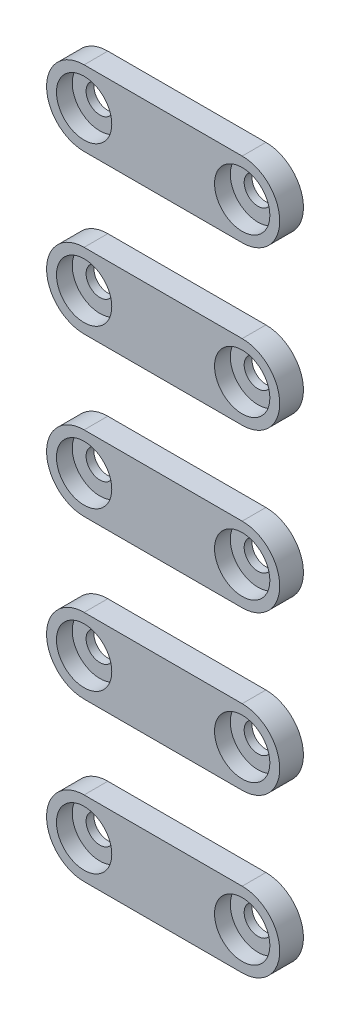
from build123d import *

# Parameters (mm, degrees)
BOSS_EXTRUDE1_DEPTH   = 3
BOSS_EXTRUDE1_2_DEPTH = 3
BOSS_EXTRUDE1_3_DEPTH = 3
BOSS_EXTRUDE1_4_DEPTH = 3
BOSS_EXTRUDE1_5_DEPTH = 3
SKETCH2_R             = 1.75
CUT_EXTRUDE1_DEPTH    = 3
SKETCH3_R             = 3.5
CUT_EXTRUDE2_DEPTH    = 2


with BuildPart() as part:
    # Sketch1 → Boss-Extrude1 (new body)
    with BuildSketch(Plane.XY.offset(-1)):
        with BuildLine():
            Line((10, -4.75), (-10, -4.75))
            ThreePointArc((-10, -4.75), (-14.75, 0), (-10, 4.75))
            Line((-10, 4.75), (10, 4.75))
            ThreePointArc((10, 4.75), (14.75, 0), (10, -4.75))
        make_face()
    extrude(amount=BOSS_EXTRUDE1_DEPTH)


with BuildPart() as body_2:
    # Sketch1 → Boss-Extrude1 2 (new body)
    with BuildSketch(Plane.XY.offset(-1)):
        with BuildLine():
            Line((10, 15.25), (-10, 15.25))
            ThreePointArc((-10, 15.25), (-14.75, 20), (-10, 24.75))
            Line((-10, 24.75), (10, 24.75))
            ThreePointArc((10, 24.75), (14.75, 20), (10, 15.25))
        make_face()
    extrude(amount=BOSS_EXTRUDE1_2_DEPTH)


with BuildPart() as body_3:
    # Sketch1 → Boss-Extrude1 3 (new body)
    with BuildSketch(Plane.XY.offset(-1)):
        with BuildLine():
            Line((10, 35.25), (-10, 35.25))
            ThreePointArc((-10, 35.25), (-14.75, 40), (-10, 44.75))
            Line((-10, 44.75), (10, 44.75))
            ThreePointArc((10, 44.75), (14.75, 40), (10, 35.25))
        make_face()
    extrude(amount=BOSS_EXTRUDE1_3_DEPTH)


with BuildPart() as body_4:
    # Sketch1 → Boss-Extrude1 4 (new body)
    with BuildSketch(Plane.XY.offset(-1)):
        with BuildLine():
            Line((10, -24.75), (-10, -24.75))
            ThreePointArc((-10, -24.75), (-14.75, -20), (-10, -15.25))
            Line((-10, -15.25), (10, -15.25))
            ThreePointArc((10, -15.25), (14.75, -20), (10, -24.75))
        make_face()
    extrude(amount=BOSS_EXTRUDE1_4_DEPTH)


with BuildPart() as body_5:
    # Sketch1 → Boss-Extrude1 5 (new body)
    with BuildSketch(Plane.XY.offset(-1)):
        with BuildLine():
            Line((10, -44.75), (-10, -44.75))
            ThreePointArc((-10, -44.75), (-14.75, -40), (-10, -35.25))
            Line((-10, -35.25), (10, -35.25))
            ThreePointArc((10, -35.25), (14.75, -40), (10, -44.75))
        make_face()
    extrude(amount=BOSS_EXTRUDE1_5_DEPTH)


with BuildPart() as cut_extrude1_tool:
    # Sketch2 → Cut-Extrude1 (new body)
    with BuildSketch(Plane.XY.offset(2)):
        with Locations((-10, 40)):
            Circle(SKETCH2_R)
        with Locations((10, 40)):
            Circle(SKETCH2_R)
        with Locations((-10, 20)):
            Circle(SKETCH2_R)
        with Locations((10, 20)):
            Circle(SKETCH2_R)
        with Locations((-10, 0)):
            Circle(SKETCH2_R)
        with Locations((10, 0)):
            Circle(SKETCH2_R)
        with Locations((-10, -20)):
            Circle(SKETCH2_R)
        with Locations((10, -20)):
            Circle(SKETCH2_R)
        with Locations((-10, -40)):
            Circle(SKETCH2_R)
        with Locations((10, -40)):
            Circle(SKETCH2_R)
    extrude(amount=-CUT_EXTRUDE1_DEPTH)


with BuildPart() as part_1:
    add(part.part)

    # Cut-Extrude1: cut by cut_extrude1_tool
    add(cut_extrude1_tool.part, mode=Mode.SUBTRACT)


with BuildPart() as body_2_1:
    add(body_2.part)

    # Cut-Extrude1: cut by cut_extrude1_tool
    add(cut_extrude1_tool.part, mode=Mode.SUBTRACT)


with BuildPart() as body_3_1:
    add(body_3.part)

    # Cut-Extrude1: cut by cut_extrude1_tool
    add(cut_extrude1_tool.part, mode=Mode.SUBTRACT)


with BuildPart() as body_4_1:
    add(body_4.part)

    # Cut-Extrude1: cut by cut_extrude1_tool
    add(cut_extrude1_tool.part, mode=Mode.SUBTRACT)


with BuildPart() as body_5_1:
    add(body_5.part)

    # Cut-Extrude1: cut by cut_extrude1_tool
    add(cut_extrude1_tool.part, mode=Mode.SUBTRACT)


with BuildPart() as cut_extrude2_tool:
    # Sketch3 → Cut-Extrude2 (new body)
    with BuildSketch(Plane.XY.offset(2)):
        with Locations((-10, 40)):
            Circle(SKETCH3_R)
        with Locations((10, 40)):
            Circle(SKETCH3_R)
        with Locations((-10, 20)):
            Circle(SKETCH3_R)
        with Locations((10, 20)):
            Circle(SKETCH3_R)
        with Locations((-10, 0)):
            Circle(SKETCH3_R)
        with Locations((10, 0)):
            Circle(SKETCH3_R)
        with Locations((-10, -20)):
            Circle(SKETCH3_R)
        with Locations((10, -20)):
            Circle(SKETCH3_R)
        with Locations((-10, -40)):
            Circle(SKETCH3_R)
        with Locations((10, -40)):
            Circle(SKETCH3_R)
    extrude(amount=-CUT_EXTRUDE2_DEPTH)


with BuildPart() as part_2:
    add(part_1.part)

    # Cut-Extrude2: cut by cut_extrude2_tool
    add(cut_extrude2_tool.part, mode=Mode.SUBTRACT)


with BuildPart() as body_2_2:
    add(body_2_1.part)

    # Cut-Extrude2: cut by cut_extrude2_tool
    add(cut_extrude2_tool.part, mode=Mode.SUBTRACT)


with BuildPart() as body_3_2:
    add(body_3_1.part)

    # Cut-Extrude2: cut by cut_extrude2_tool
    add(cut_extrude2_tool.part, mode=Mode.SUBTRACT)


with BuildPart() as body_4_2:
    add(body_4_1.part)

    # Cut-Extrude2: cut by cut_extrude2_tool
    add(cut_extrude2_tool.part, mode=Mode.SUBTRACT)


with BuildPart() as body_5_2:
    add(body_5_1.part)

    # Cut-Extrude2: cut by cut_extrude2_tool
    add(cut_extrude2_tool.part, mode=Mode.SUBTRACT)


solid = Compound([part_2.part, body_2_2.part, body_3_2.part, body_4_2.part, body_5_2.part])
